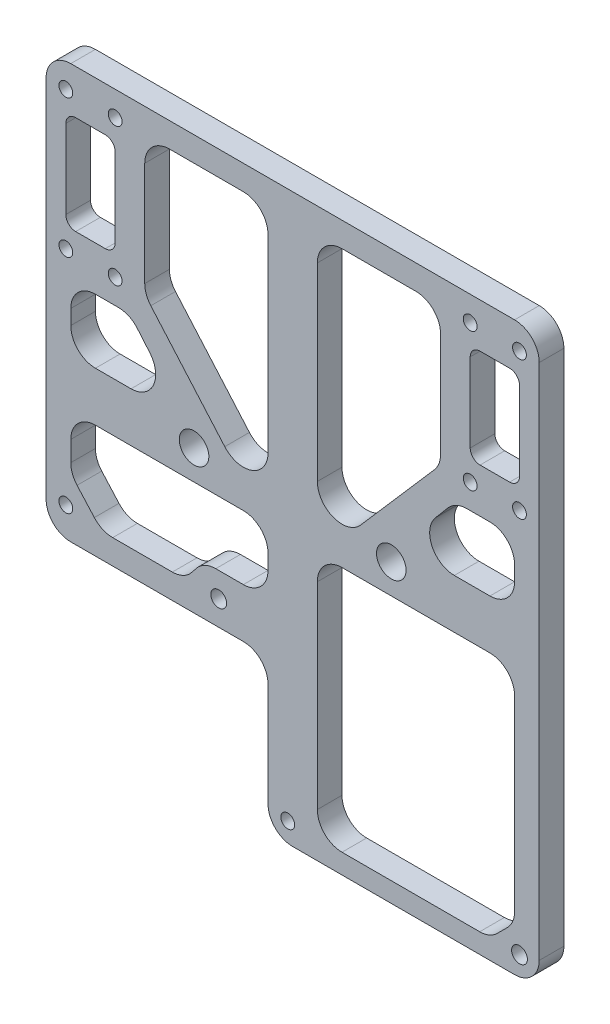
from build123d import *

# Parameters (mm, degrees)
SKETCH_1_R      = 1.4
SKETCH_1_R_2    = 3
SKETCH_1_R_3    = 1.6
EXTRUDE_1_DEPTH = 5


with BuildPart() as part:
    # ｽｹｯﾁ1 → ﾎﾞｽ - 押し出し1 (new body)
    with BuildSketch(Plane.XY):
        with BuildLine():
            Line((-45, 57.5), (45, 57.5))
            ThreePointArc((45, 57.5), (48.535533906, 56.035533906), (50, 52.5))
            Line((50, 52.5), (50, -52.5))
            ThreePointArc((50, -52.5), (48.535533906, -56.035533906), (45, -57.5))
            Line((45, -57.5), (0, -57.5))
            ThreePointArc((0, -57.5), (-3.535533906, -56.035533906), (-5, -52.5))
            Line((-5, -52.5), (-5, -31.5))
            ThreePointArc((-5, -31.5), (-6.464466094, -27.964466094), (-10, -26.5))
            Line((-10, -26.5), (-45, -26.5))
            ThreePointArc((-45, -26.5), (-48.535533906, -25.035533906), (-50, -21.5))
            Line((-50, -21.5), (-50, 52.5))
            ThreePointArc((-50, 52.5), (-48.535533906, 56.035533906), (-45, 57.5))
        make_face()
        with Locations((-46, 52.5)):
            Circle(SKETCH_1_R, mode=Mode.SUBTRACT)
        with Locations((-36, 52.5)):
            Circle(SKETCH_1_R, mode=Mode.SUBTRACT)
        with Locations((-46, 24.5)):
            Circle(SKETCH_1_R, mode=Mode.SUBTRACT)
        with Locations((-36, 24.5)):
            Circle(SKETCH_1_R, mode=Mode.SUBTRACT)
        with Locations((46, 24.5)):
            Circle(SKETCH_1_R, mode=Mode.SUBTRACT)
        with Locations((36, 24.5)):
            Circle(SKETCH_1_R, mode=Mode.SUBTRACT)
        with Locations((36, 52.5)):
            Circle(SKETCH_1_R, mode=Mode.SUBTRACT)
        with Locations((46, 52.5)):
            Circle(SKETCH_1_R, mode=Mode.SUBTRACT)
        with Locations((-20, 2.5)):
            Circle(SKETCH_1_R_2, mode=Mode.SUBTRACT)
        with Locations((20, 2.5)):
            Circle(SKETCH_1_R_2, mode=Mode.SUBTRACT)
        with Locations((-1, -53.5)):
            Circle(SKETCH_1_R, mode=Mode.SUBTRACT)
        with Locations((-46, -20.5)):
            Circle(SKETCH_1_R, mode=Mode.SUBTRACT)
        with Locations((46, -53.5)):
            Circle(SKETCH_1_R_3, mode=Mode.SUBTRACT)
        with Locations((-15, -21.5)):
            Circle(SKETCH_1_R_3, mode=Mode.SUBTRACT)
        with BuildLine():
            Line((-10, 52.5), (-25, 52.5))
            ThreePointArc((-25, 52.5), (-28.535533906, 51.035533906), (-30, 47.5))
            Line((-30, 47.5), (-30, 26.369875327))
            ThreePointArc((-30, 26.369875327), (-29.683222077, 24.618467044), (-28.773027611, 23.088981752))
            Line((-28.773027611, 23.088981752), (-13.773027611, 5.838981752))
            ThreePointArc((-13.773027611, 5.838981752), (-8.248591717, 4.43665325), (-5, 9.119875327))
            Line((-5, 9.119875327), (-5, 47.5))
            ThreePointArc((-5, 47.5), (-6.464466094, 51.035533906), (-10, 52.5))
        make_face(mode=Mode.SUBTRACT)
        with BuildLine():
            Line((-40, 19.5), (-35.318994756, 19.5))
            ThreePointArc((-35.318994756, 19.5), (-33.215254758, 19.035887787), (-31.502063329, 17.729711207))
            Line((-31.502063329, 17.729711207), (-28.963601791, 14.729711207))
            ThreePointArc((-28.963601791, 14.729711207), (-28.24464543, 9.396260001), (-32.780533218, 6.5))
            Line((-32.780533218, 6.5), (-40, 6.5))
            ThreePointArc((-40, 6.5), (-43.535533906, 7.964466094), (-45, 11.5))
            Line((-45, 11.5), (-45, 14.5))
            ThreePointArc((-45, 14.5), (-43.535533906, 18.035533906), (-40, 19.5))
        make_face(mode=Mode.SUBTRACT)
        with BuildLine():
            Line((-40, -3.5), (-10, -3.5))
            ThreePointArc((-10, -3.5), (-6.464466094, -4.964466094), (-5, -8.5))
            Line((-5, -8.5), (-5, -11.5))
            ThreePointArc((-5, -11.5), (-6.464466094, -15.035533906), (-10, -16.5))
            Line((-10, -16.5), (-15.596875763, -16.5))
            ThreePointArc((-15.596875763, -16.5), (-17.762819415, -16.993483818), (-19.50121981, -18.376524762))
            Line((-19.50121981, -18.376524762), (-20.49878019, -19.623475238))
            ThreePointArc((-20.49878019, -19.623475238), (-22.237180585, -21.006516182), (-24.403124237, -21.5))
            Line((-24.403124237, -21.5), (-36.497595845, -21.5))
            ThreePointArc((-36.497595845, -21.5), (-38.537567248, -21.064922417), (-40.222520321, -19.835406669))
            Line((-40.222520321, -19.835406669), (-43.724924476, -15.923982291))
            ThreePointArc((-43.724924476, -15.923982291), (-44.670365209, -14.373985605), (-45, -12.588575621))
            Line((-45, -12.588575621), (-45, -8.5))
            ThreePointArc((-45, -8.5), (-43.535533906, -4.964466094), (-40, -3.5))
        make_face(mode=Mode.SUBTRACT)
        with BuildLine():
            Line((40, 6.5), (32.780533218, 6.5))
            ThreePointArc((32.780533218, 6.5), (28.24464543, 9.396260001), (28.963601791, 14.729711207))
            Line((28.963601791, 14.729711207), (31.502063329, 17.729711207))
            ThreePointArc((31.502063329, 17.729711207), (33.215254758, 19.035887787), (35.318994756, 19.5))
            Line((35.318994756, 19.5), (40, 19.5))
            ThreePointArc((40, 19.5), (43.535533906, 18.035533906), (45, 14.5))
            Line((45, 14.5), (45, 11.5))
            ThreePointArc((45, 11.5), (43.535533906, 7.964466094), (40, 6.5))
        make_face(mode=Mode.SUBTRACT)
        with BuildLine():
            Line((-44, 48.5), (-38, 48.5))
            ThreePointArc((-38, 48.5), (-36.585786438, 47.914213562), (-36, 46.5))
            Line((-36, 46.5), (-36, 30.5))
            ThreePointArc((-36, 30.5), (-36.585786438, 29.085786438), (-38, 28.5))
            Line((-38, 28.5), (-44, 28.5))
            ThreePointArc((-44, 28.5), (-45.414213562, 29.085786438), (-46, 30.5))
            Line((-46, 30.5), (-46, 46.5))
            ThreePointArc((-46, 46.5), (-45.414213562, 47.914213562), (-44, 48.5))
        make_face(mode=Mode.SUBTRACT)
        with BuildLine():
            Line((30, 47.5), (30, 26.369875327))
            ThreePointArc((30, 26.369875327), (29.683222077, 24.618467044), (28.773027611, 23.088981752))
            Line((28.773027611, 23.088981752), (13.773027611, 5.838981752))
            ThreePointArc((13.773027611, 5.838981752), (8.248591717, 4.43665325), (5, 9.119875327))
            Line((5, 9.119875327), (5, 47.5))
            ThreePointArc((5, 47.5), (6.464466094, 51.035533906), (10, 52.5))
            Line((10, 52.5), (25, 52.5))
            ThreePointArc((25, 52.5), (28.535533906, 51.035533906), (30, 47.5))
        make_face(mode=Mode.SUBTRACT)
        with BuildLine():
            Line((44, 28.5), (38, 28.5))
            ThreePointArc((38, 28.5), (36.585786438, 29.085786438), (36, 30.5))
            Line((36, 30.5), (36, 46.5))
            ThreePointArc((36, 46.5), (36.585786438, 47.914213562), (38, 48.5))
            Line((38, 48.5), (44, 48.5))
            ThreePointArc((44, 48.5), (45.414213562, 47.914213562), (46, 46.5))
            Line((46, 46.5), (46, 30.5))
            ThreePointArc((46, 30.5), (45.414213562, 29.085786438), (44, 28.5))
        make_face(mode=Mode.SUBTRACT)
        with BuildLine():
            Line((10, -3.5), (40, -3.5))
            ThreePointArc((40, -3.5), (43.535533906, -4.964466094), (45, -8.5))
            Line((45, -8.5), (45, -46.428932188))
            ThreePointArc((45, -46.428932188), (44.619397663, -48.34234935), (43.535533906, -49.964466094))
            Line((43.535533906, -49.964466094), (41.464466094, -52.035533906))
            ThreePointArc((41.464466094, -52.035533906), (39.84234935, -53.119397663), (37.928932188, -53.5))
            Line((37.928932188, -53.5), (10, -53.5))
            ThreePointArc((10, -53.5), (6.464466094, -52.035533906), (5, -48.5))
            Line((5, -48.5), (5, -8.5))
            ThreePointArc((5, -8.5), (6.464466094, -4.964466094), (10, -3.5))
        make_face(mode=Mode.SUBTRACT)
    extrude(amount=EXTRUDE_1_DEPTH)


solid = part.part
